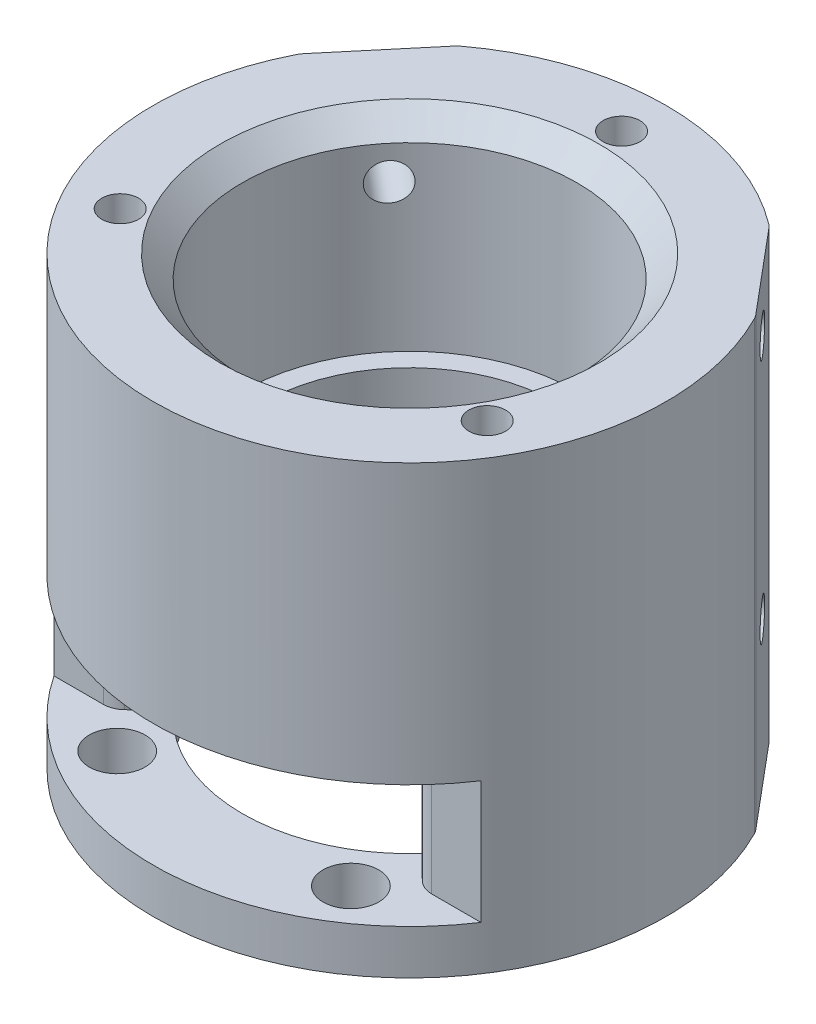
from build123d import *

# Parameters (mm, degrees)
CUT_EXTRUDE1_DEPTH         = 11
FILLET1_R                  = 2
M2_5_TAPPED_HOLE1_D        = 2.05
M2_5_TAPPED_HOLE1_DEPTH    = 6.35
M2_5_TAPPED_HOLE1_TIP      = 0.615882135
SKETCH11_OUTSIDE_W         = 67.05
SKETCH11_OUTSIDE_H         = 67.05
CUT_EXTRUDE2_DEPTH         = 77.802868599
FILLET3_R                  = 2
CHAMFER1_SIZE              = 2
M4_TAPPED_HOLE1_AT_2_COUNT = 2
M4_TAPPED_HOLE1_AT_2_PITCH = 22
SKETCH15_R                 = 1.5
CUT_EXTRUDE4_DEPTH         = 10
SKETCH8_W                  = 1.65
SKETCH8_H                  = 40
M4_TAPPED_HOLE2_AT_2_COUNT = 2
M4_TAPPED_HOLE2_AT_2_PITCH = 32.908965344
M4_TAPPED_HOLE2_AT_3_COUNT = 2
M4_TAPPED_HOLE2_AT_3_PITCH = 32.908965344
CUT_EXTRUDE6_START         = 11
SKETCH17_R                 = 2.5
CUT_EXTRUDE6_DEPTH         = 4.001
SKETCH14_R                 = 2.15
CUT_EXTRUDE3_DEPTH         = 29.575


with BuildPart() as part:
    # Sketch1 → Revolve1 (revolve)
    with BuildSketch(Plane(origin=(0, 0, 0), x_dir=(0, 0, -1), z_dir=(1, 0, 0))):
        Polygon((13.2, 44.575), (13.2, 51.375), (15, 51.375), (15, 69.575), (23, 69.575), (23, 0), (13.2, 0), (9.5, 0), (9.5, 4), (15, 4), (15, 44.575), align=None)
    revolve(axis=Axis((0, 0, 0), (0, 1, 0)))

    # Sketch5 → Cut-Extrude1 (cut)
    with BuildSketch(Plane(origin=(0, 44.575, 0), x_dir=(-1, 0, 0), z_dir=(0, -1, 0))):
        with BuildLine():
            Line((-13.5, -18.62122445), (-13.5, -25.735977403))
            Line((-13.5, -25.735977403), (13.5, -25.735977403))
            Line((13.5, -25.735977403), (13.5, -18.62122445))
            ThreePointArc((13.5, -18.62122445), (16.584015432, -15.936449797), (19.14388926, -12.748))
            Line((19.14388926, -12.748), (13.93421226, -12.748))
            Line((13.93421226, -12.748), (11.092149393, -10.0977335))
            ThreePointArc((11.092149393, -10.0977335), (0, -15), (-11.092149393, -10.0977335))
            Line((-11.092149393, -10.0977335), (-13.93421226, -12.748))
            Line((-13.93421226, -12.748), (-19.14388926, -12.748))
            ThreePointArc((-19.14388926, -12.748), (-16.584015432, -15.936449797), (-13.5, -18.62122445))
        make_face()
        with BuildLine():
            Line((-7.5, -6.748), (-9.775605232, -8.870036209))
            ThreePointArc((-9.775605232, -8.870036209), (0, -13.2), (9.775605232, -8.870036209))
            Line((9.775605232, -8.870036209), (7.5, -6.748))
            Line((7.5, -6.748), (-7.5, -6.748))
        make_face()
    extrude(amount=CUT_EXTRUDE1_DEPTH, mode=Mode.SUBTRACT)

    # Fillet1
    fillet1_edges = [part.edges().sort_by_distance(p)[0] for p in [
        (11.092149393, 39.075, 10.0977335),
        (-11.092149393, 39.075, 10.0977335),
        (-13.93421226, 39.075, 12.748),
        (13.93421226, 39.075, 12.748),
    ]]
    fillet(fillet1_edges, radius=FILLET1_R)

    # M2.5 Tapped Hole1
    with Locations(Plane.XZ.offset(-44.575)):
        with Locations((-10.4775, 15.748), (10.4775, 15.748)):
            Hole(M2_5_TAPPED_HOLE1_D / 2, depth=M2_5_TAPPED_HOLE1_DEPTH)
            with Locations((0, 0, -(M2_5_TAPPED_HOLE1_DEPTH + M2_5_TAPPED_HOLE1_TIP / 2))):  # 118° drill point
                Cone(0, M2_5_TAPPED_HOLE1_D / 2, M2_5_TAPPED_HOLE1_TIP, mode=Mode.SUBTRACT)

    # Sketch11 outside → Cut-Extrude2 (cut, through all)
    with BuildSketch(Plane(origin=(0, 0, 0), x_dir=(1, 0, 0), z_dir=(0, 1, 0))):
        Rectangle(SKETCH11_OUTSIDE_W, SKETCH11_OUTSIDE_H)
        with BuildLine():
            Line((13.983717047, 18.260768263), (20.411593144, 10.600323832))
            ThreePointArc((20.411593144, 10.600323832), (0, -23), (-20.411593144, 10.600323832))
            Line((-20.411593144, 10.600323832), (-13.983717047, 18.260768263))
            ThreePointArc((-13.983717047, 18.260768263), (0, 23), (13.983717047, 18.260768263))
        make_face(mode=Mode.SUBTRACT)
    extrude(amount=CUT_EXTRUDE2_DEPTH, mode=Mode.SUBTRACT)

    # Fillet3
    fillet3_edges = [part.edges().sort_by_distance(p)[0] for p in [
        (13.983717047, 34.7875, -18.260768263),
        (-13.983717047, 34.7875, -18.260768263),
        (-20.411593144, 34.7875, -10.600323832),
        (20.411593144, 34.7875, -10.600323832),
    ]]
    fillet(fillet3_edges, radius=FILLET3_R)

    # Chamfer1
    chamfer1_edges = [part.edges().sort_by_distance(p)[0] for p in [
        (0, 69.575, 15),
    ]]
    chamfer(chamfer1_edges, length=CHAMFER1_SIZE)

    # Sketch12 → M4 Tapped Hole1 (revolve, cut)
    with BuildSketch(Plane(origin=(17.197655095, 42.575, -14.430546047), x_dir=(-0.6427876096865435, 0, -0.7660444431189747), z_dir=(0, 1, 0))):
        Polygon((0, 0), (0, 11.091420021), (1.65, 10.1), (1.65, 0), align=None)
    m4_tapped_hole1 = revolve(axis=Axis((22.062037309, 42.575, -18.512247369), (-0.7660444431189746, 0, 0.6427876096865436)), mode=Mode.SUBTRACT)

    # M4 Tapped Hole1 at 2: M4 Tapped Hole1 ×2
    with Locations(*[(0, i * M4_TAPPED_HOLE1_AT_2_PITCH, 0) for i in range(1, M4_TAPPED_HOLE1_AT_2_COUNT)]):
        add(m4_tapped_hole1, mode=Mode.SUBTRACT)

    # Mirror1: M4 Tapped Hole1 across plane
    add(m4_tapped_hole1.mirror(Plane(origin=(0, 0, 0), x_dir=(0, 0, 1), z_dir=(1, 0, 0))), mode=Mode.SUBTRACT)

    # Mirror1 copy 1 sketch → Mirror1 copy 1 (revolve, cut)
    with BuildSketch(Plane(origin=(-17.197655095, 64.575, -14.430546047), x_dir=(0.6427876096865435, 0, -0.7660444431189747), z_dir=(0, 1, 0))):
        Polygon((0, 0), (0, -11.091420021), (1.65, -10.1), (1.65, 0), align=None)
    revolve(axis=Axis((-22.062037309, 64.575, -18.512247369), (-0.7660444431189746, 0, -0.6427876096865436)), mode=Mode.SUBTRACT)

    # Sketch15 → Cut-Extrude4 (cut)
    with BuildSketch(Plane.XZ):
        with Locations(Location((-9.192388155, -9.192388155, 0), (0, 0, 270))):
            Circle(SKETCH15_R)
        with Locations(Location((-9.192388155, 9.192388155, 0), (0, 0, 270))):
            Circle(SKETCH15_R)
        with Locations(Location((9.192388155, 9.192388155, 0), (0, 0, 270))):
            Circle(SKETCH15_R)
        with Locations(Location((9.192388155, -9.192388155, 0), (0, 0, 270))):
            Circle(SKETCH15_R)
    extrude(amount=-CUT_EXTRUDE4_DEPTH, mode=Mode.SUBTRACT)


with BuildPart() as body_2:
    # Split1: the piece on the far side of the plane
    add(part.part)
    split(bisect_by=Plane.ZX.offset(29.575), keep=Keep.BOTTOM)

    # Sketch14 → Cut-Extrude3 (cut)
    with BuildSketch(Plane.XZ):
        with Locations(Location((-16.454482672, 9.5, 0), (0, 0, 270))):
            Circle(SKETCH14_R)
        with Locations(Location((16.454482672, 9.5, 0), (0, 0, 270))):
            Circle(SKETCH14_R)
        with Locations(Location((0, -19, 0), (0, 0, 270))):
            Circle(SKETCH14_R)
    extrude(amount=-CUT_EXTRUDE3_DEPTH, mode=Mode.SUBTRACT)


with BuildPart() as part_1:
    add(part.part)

    # Split1
    split(bisect_by=Plane.ZX.offset(29.575), keep=Keep.TOP)

    # Sketch8 → M4 Tapped Hole2 (revolve, cut)
    with BuildSketch(Plane(origin=(-16.454482672, 69.575, 9.5), x_dir=(0, 0, 1), z_dir=(1, 0, 0))):
        with Locations((0.825, 20)):
            Rectangle(SKETCH8_W, SKETCH8_H)
    m4_tapped_hole2 = revolve(axis=Axis((-16.454482672, 75.925, 9.5), (0, -1, 0)), mode=Mode.SUBTRACT)

    # M4 Tapped Hole2 at 2: M4 Tapped Hole2 ×2
    with Locations(*[Vector(0.499999999999998, 0, -0.8660254037844398) * (i * M4_TAPPED_HOLE2_AT_2_PITCH) for i in range(1, M4_TAPPED_HOLE2_AT_2_COUNT)]):
        add(m4_tapped_hole2, mode=Mode.SUBTRACT)

    # M4 Tapped Hole2 at 3: M4 Tapped Hole2 ×2
    with Locations(*[(i * M4_TAPPED_HOLE2_AT_3_PITCH, 0, 0) for i in range(1, M4_TAPPED_HOLE2_AT_3_COUNT)]):
        add(m4_tapped_hole2, mode=Mode.SUBTRACT)

    # Sketch17 → Cut-Extrude6 (cut)
    with BuildSketch(Plane.XZ.offset(-44.575).offset(CUT_EXTRUDE6_START)):
        with Locations(Location((10.4775, 15.748, 0), (0, 0, 90))):
            Circle(SKETCH17_R)
        with Locations(Location((-10.4775, 15.748, 0), (0, 0, 90))):
            Circle(SKETCH17_R)
    extrude(amount=CUT_EXTRUDE6_DEPTH, mode=Mode.SUBTRACT)


solid = part_1.part
